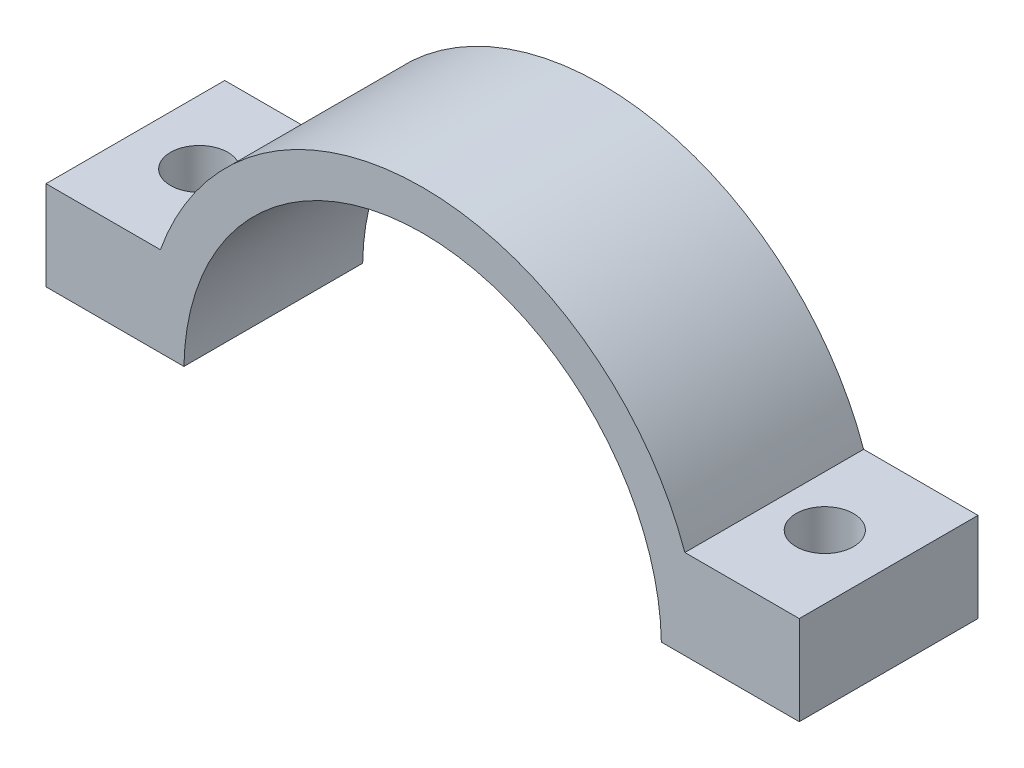
from build123d import *

# Parameters (mm, degrees)
BOLTED_CAP_AND_EARS_DEPTH   = 14
M4_THROUGH_HOLES_DEPTH      = 60.969492244
M4_THROUGH_HOLES_DEPTH_BACK = 60.969492244
SKETCH2_R                   = 2.25


with BuildPart() as part:
    # Bolted cap and ears profile → Bolted cap and ears (new body)
    with BuildSketch(Plane.XY):
        with BuildLine():
            Line((20.541421567, 35.8), (29.5, 35.8))
            Line((29.5, 35.8), (29.5, 28.8))
            Line((29.5, 28.8), (18.697593428, 28.8))
            ThreePointArc((18.697593428, 28.8), (0, 47.2), (-18.697593428, 28.8))
            Line((-18.697593428, 28.8), (-29.5, 28.8))
            Line((-29.5, 28.8), (-29.5, 35.8))
            Line((-29.5, 35.8), (-20.541421567, 35.8))
            ThreePointArc((-20.541421567, 35.8), (0, 50.3), (20.541421567, 35.8))
        make_face()
    extrude(amount=BOLTED_CAP_AND_EARS_DEPTH)

    # Sketch2 → M4 through holes (cut, two sides: drawn at the far end of the back side and taken through both)
    with BuildSketch(Plane(origin=(0, 0, 0), x_dir=(1, 0, 0), z_dir=(0, 1, 0)).offset(-M4_THROUGH_HOLES_DEPTH_BACK)):
        with Locations(Location((-24.5, -7, 0), (0, 0, 90))):
            Circle(SKETCH2_R)
        with Locations(Location((24.5, -7, 0), (0, 0, 90))):
            Circle(SKETCH2_R)
    extrude(amount=M4_THROUGH_HOLES_DEPTH + M4_THROUGH_HOLES_DEPTH_BACK, mode=Mode.SUBTRACT)


solid = part.part
